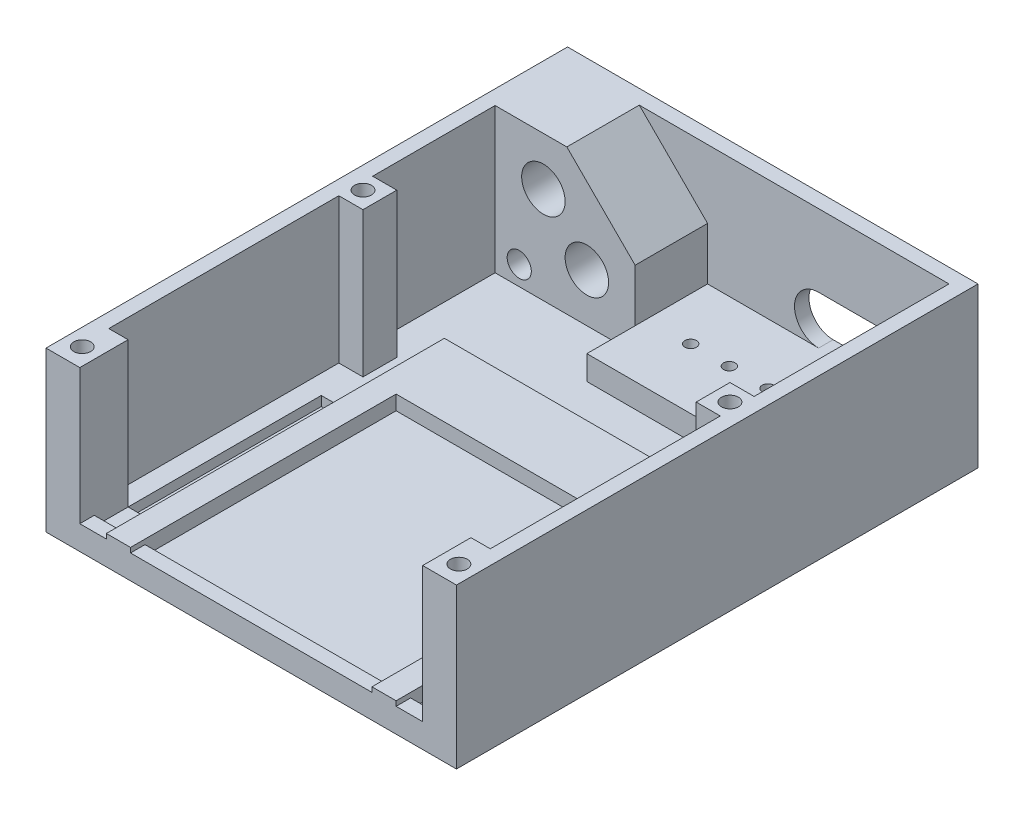
from build123d import *

# Parameters (mm, degrees)
SKETCH2_W                    = 79
SKETCH2_H                    = 105
BOSS_EXTRUDE1_DEPTH          = 3
SKETCH3_W                    = 60
SKETCH3_H                    = 70
SUPPORT_DEPTH                = 3
SKETCH4_W                    = 50
SKETCH4_H                    = 55
REMOVE_PLASTIC_DEPTH         = 3
SKETCH5_W                    = 50
SKETCH5_H                    = 25
BOSS_EXTRUDE3_DEPTH          = 5
SKETCH6_R                    = 1.2
CUT_EXTRUDE2_DEPTH           = 5
CUT_EXTRUDE2_DRAFT           = -5
CUT_EXTRUDE2_PROFILE_2_DEPTH = 5
CUT_EXTRUDE2_PROFILE_2_DRAFT = -5
CUT_EXTRUDE2_PROFILE_3_DEPTH = 5
CUT_EXTRUDE2_PROFILE_3_DRAFT = -5
CUT_EXTRUDE2_PROFILE_4_DEPTH = 5
CUT_EXTRUDE2_PROFILE_4_DRAFT = -5
CUT_EXTRUDE2_PROFILE_5_DEPTH = 5
CUT_EXTRUDE2_PROFILE_5_DRAFT = -5
SKETCH7_W                    = 29
SKETCH7_H                    = 15
BOSS_EXTRUDE4_DEPTH          = 30
BOSS_EXTRUDE5_DEPTH          = 33
SKETCH8_R                    = 4.5
SKETCH8_R_2                  = 2.5
CUT_EXTRUDE3_DEPTH           = 31
SKETCH10_W                   = 4
SKETCH10_H                   = 10
BOSS_EXTRUDE6_DEPTH          = 30
CUT_EXTRUDE4_DEPTH           = 3
CUT_EXTRUDE5_DEPTH           = 15
SKETCH13_W                   = 5
SKETCH13_H                   = 7
BOSS_EXTRUDE7_DEPTH          = 30
SKETCH14_R                   = 1.75
CUT_EXTRUDE6_DEPTH           = 20
CUT_EXTRUDE6_DRAFT           = -2
CUT_EXTRUDE6_PROFILE_2_DEPTH = 20
CUT_EXTRUDE6_PROFILE_2_DRAFT = -2
CUT_EXTRUDE6_PROFILE_3_DEPTH = 20
CUT_EXTRUDE6_PROFILE_3_DRAFT = -2
CUT_EXTRUDE6_PROFILE_4_DEPTH = 20
CUT_EXTRUDE6_PROFILE_4_DRAFT = -2
SKETCH16_W                   = 5.5
SKETCH16_H                   = 40
SLIDERS_DEPTH                = 2
SKETCH17_W                   = 71
SKETCH17_H                   = 2
BOSS_EXTRUDE9_DEPTH          = 3


with BuildPart() as part:
    # Sketch2 → Boss-Extrude1 (new body)
    with BuildSketch(Plane(origin=(0, 0, 0), x_dir=(1, 0, 0), z_dir=(0, 1, 0))):
        Rectangle(SKETCH2_W, SKETCH2_H)
    extrude(amount=BOSS_EXTRUDE1_DEPTH)

    # Sketch3 → support (add)
    with BuildSketch(Plane(origin=(0, 3, 0), x_dir=(1, 0, 0), z_dir=(0, 1, 0))):
        with Locations((0, -17.5)):
            Rectangle(SKETCH3_W, SKETCH3_H)
    extrude(amount=SUPPORT_DEPTH)

    # Sketch4 → remove plastic (cut)
    with BuildSketch(Plane(origin=(0, 6, 0), x_dir=(1, 0, 0), z_dir=(0, 1, 0))):
        with Locations((0, -25)):
            Rectangle(SKETCH4_W, SKETCH4_H)
    extrude(amount=-REMOVE_PLASTIC_DEPTH, mode=Mode.SUBTRACT)

    # Sketch5 → Boss-Extrude3 (add)
    with BuildSketch(Plane(origin=(0, 3, 0), x_dir=(1, 0, 0), z_dir=(0, 1, 0))):
        with Locations((14.5, 40)):
            Rectangle(SKETCH5_W, SKETCH5_H)
    extrude(amount=BOSS_EXTRUDE3_DEPTH)


with BuildPart() as cut_extrude2_tool:
    # Sketch6 → Cut-Extrude2 (with draft: the straight prism first)
    with BuildSketch(Plane(origin=(0, 8, 0), x_dir=(1, 0, 0), z_dir=(0, 1, 0))):
        with Locations((-1.5, 40)):
            Circle(SKETCH6_R)
    extrude(amount=-CUT_EXTRUDE2_DEPTH)
    # Cut-Extrude2: the draft: its side faces are tilted about the plane it starts from
    cut_extrude2_sides = [cut_extrude2_tool.faces().sort_by_distance(p)[0] for p in [
        (-2.7, 5.5, -40),
    ]]
    draft(cut_extrude2_sides, Plane(origin=(0, 8, 0), x_dir=(1, 0, 0), z_dir=(0, 1, 0)), CUT_EXTRUDE2_DRAFT)


with BuildPart() as part_1:
    add(part.part)

    # Cut-Extrude2: cut by cut_extrude2_tool
    add(cut_extrude2_tool.part, mode=Mode.SUBTRACT)


with BuildPart() as cut_extrude2_profile_2_tool:
    # Sketch6 → Cut-Extrude2 profile 2 (with draft: the straight prism first)
    with BuildSketch(Plane(origin=(0, 8, 0), x_dir=(1, 0, 0), z_dir=(0, 1, 0))):
        with Locations((6.5, 40)):
            Circle(SKETCH6_R)
    extrude(amount=-CUT_EXTRUDE2_PROFILE_2_DEPTH)
    # Cut-Extrude2 profile 2: the draft: its side faces are tilted about the plane it starts from
    cut_extrude2_profile_2_sides = [cut_extrude2_profile_2_tool.faces().sort_by_distance(p)[0] for p in [
        (5.3, 5.5, -40),
    ]]
    draft(cut_extrude2_profile_2_sides, Plane(origin=(0, 8, 0), x_dir=(1, 0, 0), z_dir=(0, 1, 0)), CUT_EXTRUDE2_PROFILE_2_DRAFT)


with BuildPart() as part_2:
    add(part_1.part)

    # Cut-Extrude2 profile 2: cut by cut_extrude2_profile_2_tool
    add(cut_extrude2_profile_2_tool.part, mode=Mode.SUBTRACT)


with BuildPart() as cut_extrude2_profile_3_tool:
    # Sketch6 → Cut-Extrude2 profile 3 (with draft: the straight prism first)
    with BuildSketch(Plane(origin=(0, 8, 0), x_dir=(1, 0, 0), z_dir=(0, 1, 0))):
        with Locations((14.5, 40)):
            Circle(SKETCH6_R)
    extrude(amount=-CUT_EXTRUDE2_PROFILE_3_DEPTH)
    # Cut-Extrude2 profile 3: the draft: its side faces are tilted about the plane it starts from
    cut_extrude2_profile_3_sides = [cut_extrude2_profile_3_tool.faces().sort_by_distance(p)[0] for p in [
        (13.3, 5.5, -40),
    ]]
    draft(cut_extrude2_profile_3_sides, Plane(origin=(0, 8, 0), x_dir=(1, 0, 0), z_dir=(0, 1, 0)), CUT_EXTRUDE2_PROFILE_3_DRAFT)


with BuildPart() as part_3:
    add(part_2.part)

    # Cut-Extrude2 profile 3: cut by cut_extrude2_profile_3_tool
    add(cut_extrude2_profile_3_tool.part, mode=Mode.SUBTRACT)


with BuildPart() as cut_extrude2_profile_4_tool:
    # Sketch6 → Cut-Extrude2 profile 4 (with draft: the straight prism first)
    with BuildSketch(Plane(origin=(0, 8, 0), x_dir=(1, 0, 0), z_dir=(0, 1, 0))):
        with Locations((22.5, 40)):
            Circle(SKETCH6_R)
    extrude(amount=-CUT_EXTRUDE2_PROFILE_4_DEPTH)
    # Cut-Extrude2 profile 4: the draft: its side faces are tilted about the plane it starts from
    cut_extrude2_profile_4_sides = [cut_extrude2_profile_4_tool.faces().sort_by_distance(p)[0] for p in [
        (21.3, 5.5, -40),
    ]]
    draft(cut_extrude2_profile_4_sides, Plane(origin=(0, 8, 0), x_dir=(1, 0, 0), z_dir=(0, 1, 0)), CUT_EXTRUDE2_PROFILE_4_DRAFT)


with BuildPart() as part_4:
    add(part_3.part)

    # Cut-Extrude2 profile 4: cut by cut_extrude2_profile_4_tool
    add(cut_extrude2_profile_4_tool.part, mode=Mode.SUBTRACT)


with BuildPart() as cut_extrude2_profile_5_tool:
    # Sketch6 → Cut-Extrude2 profile 5 (with draft: the straight prism first)
    with BuildSketch(Plane(origin=(0, 8, 0), x_dir=(1, 0, 0), z_dir=(0, 1, 0))):
        with Locations((30.5, 40)):
            Circle(SKETCH6_R)
    extrude(amount=-CUT_EXTRUDE2_PROFILE_5_DEPTH)
    # Cut-Extrude2 profile 5: the draft: its side faces are tilted about the plane it starts from
    cut_extrude2_profile_5_sides = [cut_extrude2_profile_5_tool.faces().sort_by_distance(p)[0] for p in [
        (29.3, 5.5, -40),
    ]]
    draft(cut_extrude2_profile_5_sides, Plane(origin=(0, 8, 0), x_dir=(1, 0, 0), z_dir=(0, 1, 0)), CUT_EXTRUDE2_PROFILE_5_DRAFT)


with BuildPart() as part_5:
    add(part_4.part)

    # Cut-Extrude2 profile 5: cut by cut_extrude2_profile_5_tool
    add(cut_extrude2_profile_5_tool.part, mode=Mode.SUBTRACT)

    # Sketch7 → Boss-Extrude4 (add)
    with BuildSketch(Plane(origin=(0, 3, 0), x_dir=(1, 0, 0), z_dir=(0, 1, 0))):
        with Locations((-25, 45)):
            Rectangle(SKETCH7_W, SKETCH7_H)
    extrude(amount=BOSS_EXTRUDE4_DEPTH)

    # Sketch9 → Boss-Extrude5 (add)
    with BuildSketch(Plane(origin=(0, 0, 0), x_dir=(1, 0, 0), z_dir=(0, 1, 0))):
        Polygon((-39.5, 52.5), (-39.5, -52.5), (-42.5, -52.5), (-42.5, 52.5), (-42.5, 55.5), (42.5, 55.5), (42.5, 52.5), (42.5, -52.5), (39.5, -52.5), (39.5, 52.5), align=None)
    extrude(amount=BOSS_EXTRUDE5_DEPTH)

    # Sketch8 → Cut-Extrude3 (cut)
    with BuildSketch(Plane.XY.offset(-37.5)):
        with Locations((-20.5, 13)):
            Circle(SKETCH8_R)
        with Locations((-34.5, 7)):
            Circle(SKETCH8_R_2)
        with Locations((-29.5, 23)):
            Circle(SKETCH8_R)
    extrude(amount=-CUT_EXTRUDE3_DEPTH, mode=Mode.SUBTRACT)

    # Sketch10 → Boss-Extrude6 (add)
    with BuildSketch(Plane(origin=(0, 3, 0), x_dir=(1, 0, 0), z_dir=(0, 1, 0))):
        with Locations((-37.5, -47.5)):
            Rectangle(SKETCH10_W, SKETCH10_H)
        with Locations((37.5, -47.5)):
            Rectangle(SKETCH10_W, SKETCH10_H)
    extrude(amount=BOSS_EXTRUDE6_DEPTH)

    # Sketch11 → Cut-Extrude4 (cut)
    with BuildSketch(Plane.XY.offset(-52.5)):
        with BuildLine():
            Line((12.5, 18), (32.5, 18))
            ThreePointArc((32.5, 18), (37.5, 13), (32.5, 8))
            Line((32.5, 8), (12.5, 8))
            ThreePointArc((12.5, 8), (7.5, 13), (12.5, 18))
        make_face()
    extrude(amount=-CUT_EXTRUDE4_DEPTH, mode=Mode.SUBTRACT)

    # Sketch12 → Cut-Extrude5 (cut)
    with BuildSketch(Plane.XY.offset(-37.5)):
        Polygon((-24.642135624, 33), (-10.5, 18.857864376), (-10.5, 33), align=None)
    extrude(amount=-CUT_EXTRUDE5_DEPTH, mode=Mode.SUBTRACT)

    # Sketch13 → Boss-Extrude7 (add)
    with BuildSketch(Plane(origin=(0, 3, 0), x_dir=(1, 0, 0), z_dir=(0, 1, 0))):
        with Locations((-37, 8.638097353)):
            Rectangle(SKETCH13_W, SKETCH13_H)
        with Locations((37, 8.638097353)):
            Rectangle(SKETCH13_W, SKETCH13_H)
    extrude(amount=BOSS_EXTRUDE7_DEPTH)


with BuildPart() as cut_extrude6_tool:
    # Sketch14 → Cut-Extrude6 (with draft: the straight prism first)
    with BuildSketch(Plane(origin=(0, 33, 0), x_dir=(1, 0, 0), z_dir=(0, 1, 0))):
        with Locations((-39, -48.5)):
            Circle(SKETCH14_R)
    extrude(amount=-CUT_EXTRUDE6_DEPTH)
    # Cut-Extrude6: the draft: its side faces are tilted about the plane it starts from
    cut_extrude6_sides = [cut_extrude6_tool.faces().sort_by_distance(p)[0] for p in [
        (-40.75, 23, 48.5),
    ]]
    draft(cut_extrude6_sides, Plane(origin=(0, 33, 0), x_dir=(1, 0, 0), z_dir=(0, 1, 0)), CUT_EXTRUDE6_DRAFT)


with BuildPart() as part_6:
    add(part_5.part)

    # Cut-Extrude6: cut by cut_extrude6_tool
    add(cut_extrude6_tool.part, mode=Mode.SUBTRACT)


with BuildPart() as cut_extrude6_profile_2_tool:
    # Sketch14 → Cut-Extrude6 profile 2 (with draft: the straight prism first)
    with BuildSketch(Plane(origin=(0, 33, 0), x_dir=(1, 0, 0), z_dir=(0, 1, 0))):
        with Locations((39, -48.5)):
            Circle(SKETCH14_R)
    extrude(amount=-CUT_EXTRUDE6_PROFILE_2_DEPTH)
    # Cut-Extrude6 profile 2: the draft: its side faces are tilted about the plane it starts from
    cut_extrude6_profile_2_sides = [cut_extrude6_profile_2_tool.faces().sort_by_distance(p)[0] for p in [
        (37.25, 23, 48.5),
    ]]
    draft(cut_extrude6_profile_2_sides, Plane(origin=(0, 33, 0), x_dir=(1, 0, 0), z_dir=(0, 1, 0)), CUT_EXTRUDE6_PROFILE_2_DRAFT)


with BuildPart() as part_7:
    add(part_6.part)

    # Cut-Extrude6 profile 2: cut by cut_extrude6_profile_2_tool
    add(cut_extrude6_profile_2_tool.part, mode=Mode.SUBTRACT)


with BuildPart() as cut_extrude6_profile_3_tool:
    # Sketch14 → Cut-Extrude6 profile 3 (with draft: the straight prism first)
    with BuildSketch(Plane(origin=(0, 33, 0), x_dir=(1, 0, 0), z_dir=(0, 1, 0))):
        with Locations((38, 8.638097353)):
            Circle(SKETCH14_R)
    extrude(amount=-CUT_EXTRUDE6_PROFILE_3_DEPTH)
    # Cut-Extrude6 profile 3: the draft: its side faces are tilted about the plane it starts from
    cut_extrude6_profile_3_sides = [cut_extrude6_profile_3_tool.faces().sort_by_distance(p)[0] for p in [
        (36.25, 23, -8.638097353),
    ]]
    draft(cut_extrude6_profile_3_sides, Plane(origin=(0, 33, 0), x_dir=(1, 0, 0), z_dir=(0, 1, 0)), CUT_EXTRUDE6_PROFILE_3_DRAFT)


with BuildPart() as part_8:
    add(part_7.part)

    # Cut-Extrude6 profile 3: cut by cut_extrude6_profile_3_tool
    add(cut_extrude6_profile_3_tool.part, mode=Mode.SUBTRACT)


with BuildPart() as cut_extrude6_profile_4_tool:
    # Sketch14 → Cut-Extrude6 profile 4 (with draft: the straight prism first)
    with BuildSketch(Plane(origin=(0, 33, 0), x_dir=(1, 0, 0), z_dir=(0, 1, 0))):
        with Locations((-38, 8.638097353)):
            Circle(SKETCH14_R)
    extrude(amount=-CUT_EXTRUDE6_PROFILE_4_DEPTH)
    # Cut-Extrude6 profile 4: the draft: its side faces are tilted about the plane it starts from
    cut_extrude6_profile_4_sides = [cut_extrude6_profile_4_tool.faces().sort_by_distance(p)[0] for p in [
        (-39.75, 23, -8.638097353),
    ]]
    draft(cut_extrude6_profile_4_sides, Plane(origin=(0, 33, 0), x_dir=(1, 0, 0), z_dir=(0, 1, 0)), CUT_EXTRUDE6_PROFILE_4_DRAFT)


with BuildPart() as part_9:
    add(part_8.part)

    # Cut-Extrude6 profile 4: cut by cut_extrude6_profile_4_tool
    add(cut_extrude6_profile_4_tool.part, mode=Mode.SUBTRACT)

    # Sketch16 → Sliders (cut)
    with BuildSketch(Plane(origin=(0, 3, 0), x_dir=(1, 0, 0), z_dir=(0, 1, 0))):
        with Locations((-32.75, -22.5)):
            Rectangle(SKETCH16_W, SKETCH16_H)
        with Locations((32.75, -22.5)):
            Rectangle(SKETCH16_W, SKETCH16_H)
    extrude(amount=-SLIDERS_DEPTH, mode=Mode.SUBTRACT)

    # Sketch17 → Boss-Extrude9 (add)
    with BuildSketch(Plane.XY.offset(52.5)):
        with Locations((0, 4)):
            Rectangle(SKETCH17_W, SKETCH17_H)
    extrude(amount=-BOSS_EXTRUDE9_DEPTH)


solid = part_9.part
